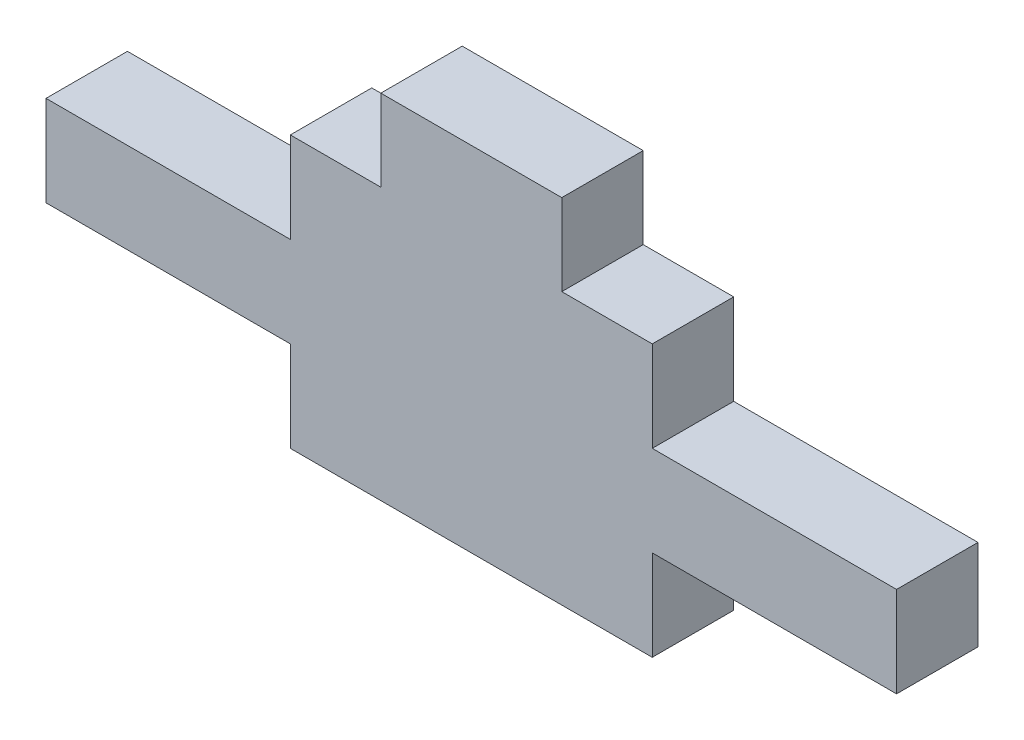
from build123d import *

# Parameters (mm, degrees)
BOSS_EXTRUDE1_DEPTH = 9


with BuildPart() as part:
    # Model → Boss-Extrude1 (new body)
    with BuildSketch(Plane.XY):
        Polygon((-20, 0), (20, 0), (20, 10), (47, 10), (47, 20), (20, 20), (20, 30), (10, 30), (10, 39), (-10, 39), (-10, 30), (-20, 30), (-20, 20), (-47, 20), (-47, 10), (-20, 10), align=None)
    extrude(amount=BOSS_EXTRUDE1_DEPTH)


solid = part.part
